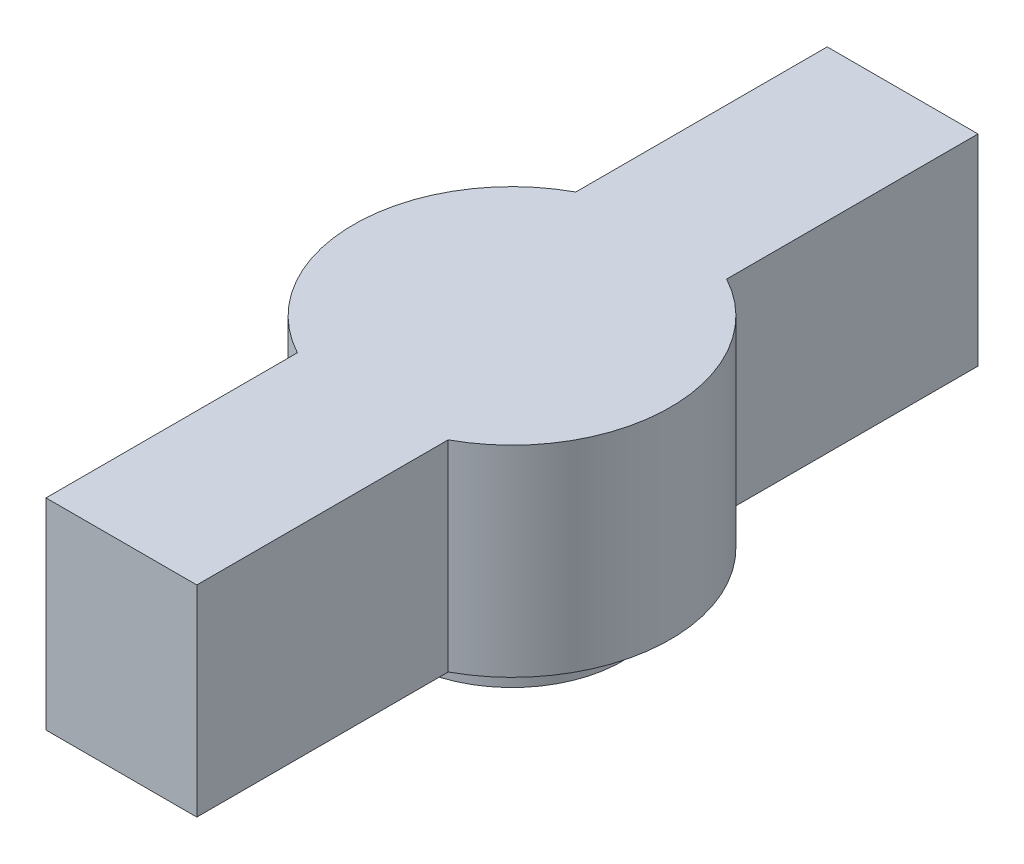
from build123d import *

# Parameters (mm, degrees)
BOSS_EXTRUDE1_DEPTH = 2.54
BOSS_EXTRUDE2_DEPTH = 12


with BuildPart() as part:
    # Sketch1 → Boss-Extrude1 (new body)
    with BuildSketch(Plane(origin=(0, 0, 0), x_dir=(1, 0, 0), z_dir=(0, 1, 0))):
        with BuildLine():
            ThreePointArc((1.27, -6.480734218), (0, -6.604), (-1.27, -6.480734218))
            Line((-1.27, -6.480734218), (-1.27, -11.560734218))
            Line((-1.27, -11.560734218), (1.27, -11.560734218))
            Line((1.27, -11.560734218), (1.27, -6.480734218))
        make_face()
        with BuildLine():
            ThreePointArc((1.27, 6.480734218), (0, 6.604), (-1.27, 6.480734218))
            ThreePointArc((-1.27, 6.480734218), (-6.604, 0), (-1.27, -6.480734218))
            ThreePointArc((-1.27, -6.480734218), (0, -6.604), (1.27, -6.480734218))
            ThreePointArc((1.27, -6.480734218), (5.099014415, -4.196768757), (6.604, 0))
            ThreePointArc((6.604, 0), (5.099014415, 4.196768757), (1.27, 6.480734218))
        make_face()
        with BuildLine():
            Line((-1.27, 11.560734218), (-1.27, 6.480734218))
            ThreePointArc((-1.27, 6.480734218), (0, 6.604), (1.27, 6.480734218))
            Line((1.27, 6.480734218), (1.27, 11.560734218))
            Line((1.27, 11.560734218), (-1.27, 11.560734218))
        make_face()
    extrude(amount=BOSS_EXTRUDE1_DEPTH)

    # Sketch2 → Boss-Extrude2 (add)
    with BuildSketch(Plane(origin=(0, 2.54, 0), x_dir=(1, 0, 0), z_dir=(0, 1, 0))):
        with BuildLine():
            Line((-4.5, 8.309783391), (-4.5, 23.309783391))
            Line((-4.5, 23.309783391), (4.5, 23.309783391))
            Line((4.5, 23.309783391), (4.5, 8.309783391))
            ThreePointArc((4.5, 8.309783391), (9.45, 0), (4.5, -8.309783391))
            Line((4.5, -8.309783391), (4.5, -23.309783391))
            Line((4.5, -23.309783391), (-4.5, -23.309783391))
            Line((-4.5, -23.309783391), (-4.5, -8.309783391))
            ThreePointArc((-4.5, -8.309783391), (-9.45, 0), (-4.5, 8.309783391))
        make_face()
    extrude(amount=BOSS_EXTRUDE2_DEPTH)


solid = part.part
